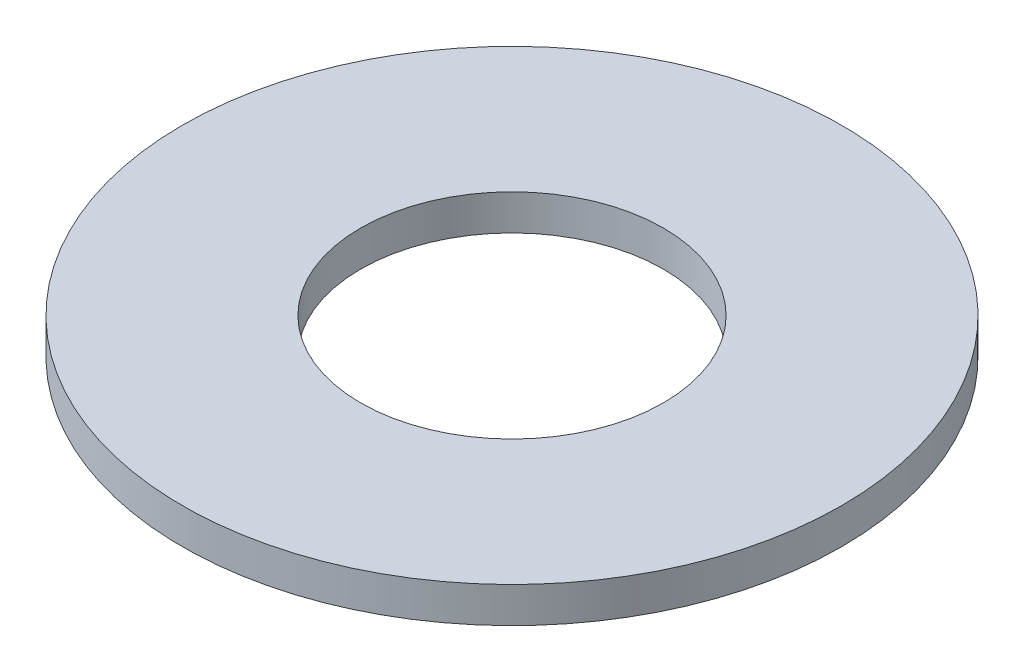
from build123d import *

# Parameters (mm, degrees)
SKETCH1_R           = 9.25
SKETCH1_R_2         = 4.25
EXTRUDE_THIN1_DEPTH = 1


with BuildPart() as part:
    # Sketch1 → Extrude-Thin1 (new body)
    with BuildSketch(Plane(origin=(0, 0, 0), x_dir=(1, 0, 0), z_dir=(0, 1, 0))):
        Circle(SKETCH1_R)
        Circle(SKETCH1_R_2, mode=Mode.SUBTRACT)
    extrude(amount=EXTRUDE_THIN1_DEPTH)


solid = part.part
